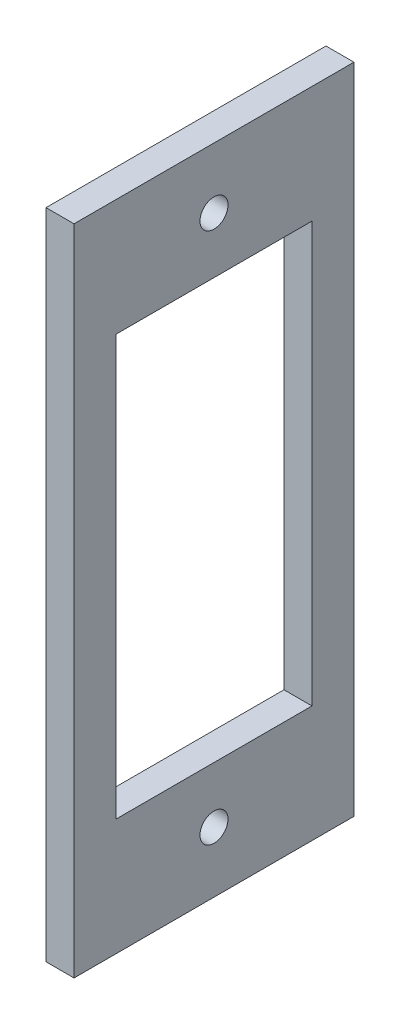
from build123d import *

# Parameters (mm, degrees)
SKETCH1_W           = 30
SKETCH1_H           = 70
BOSS_EXTRUDE1_DEPTH = 3
SKETCH2_R           = 1.5
SKETCH2_W           = 21
SKETCH2_H           = 45
CUT_EXTRUDE1_DEPTH  = 39.19685851


with BuildPart() as part:
    # Sketch1 → Boss-Extrude1 (new body)
    with BuildSketch(Plane(origin=(0, 0, 0), x_dir=(0, 0, -1), z_dir=(1, 0, 0))):
        Rectangle(SKETCH1_W, SKETCH1_H)
    extrude(amount=BOSS_EXTRUDE1_DEPTH)

    # Sketch2 → Cut-Extrude1 (cut, through all)
    with BuildSketch(Plane(origin=(3, 0, 0), x_dir=(0, 0, -1), z_dir=(1, 0, 0))):
        with Locations((0, 28.5)):
            Circle(SKETCH2_R)
        with Locations(Location((0, -28.5, 0), (0, 0, 180))):
            Circle(SKETCH2_R)
        Rectangle(SKETCH2_W, SKETCH2_H)
    extrude(amount=-CUT_EXTRUDE1_DEPTH, mode=Mode.SUBTRACT)


solid = part.part
